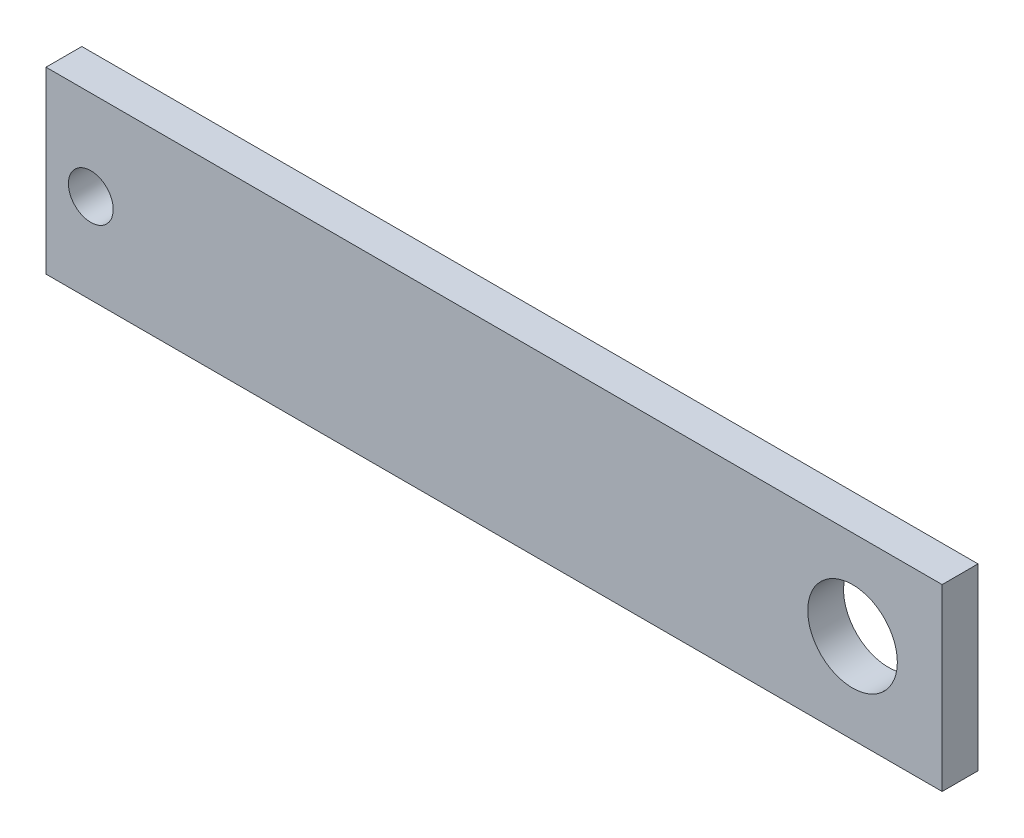
from build123d import *

# Parameters (mm, degrees)
ESQUISSE1_W        = 100
ESQUISSE1_H        = 20
ESQUISSE1_R        = 2.5
ESQUISSE1_R_2      = 5
BOSS_EXTRU_1_DEPTH = 4


with BuildPart() as part:
    # Esquisse1 → Boss.-Extru.1 (new body)
    with BuildSketch(Plane.XY):
        with Locations((50, 10)):
            Rectangle(ESQUISSE1_W, ESQUISSE1_H)
        with Locations((5, 10)):
            Circle(ESQUISSE1_R, mode=Mode.SUBTRACT)
        with Locations((90, 10)):
            Circle(ESQUISSE1_R_2, mode=Mode.SUBTRACT)
    extrude(amount=BOSS_EXTRU_1_DEPTH)


solid = part.part
